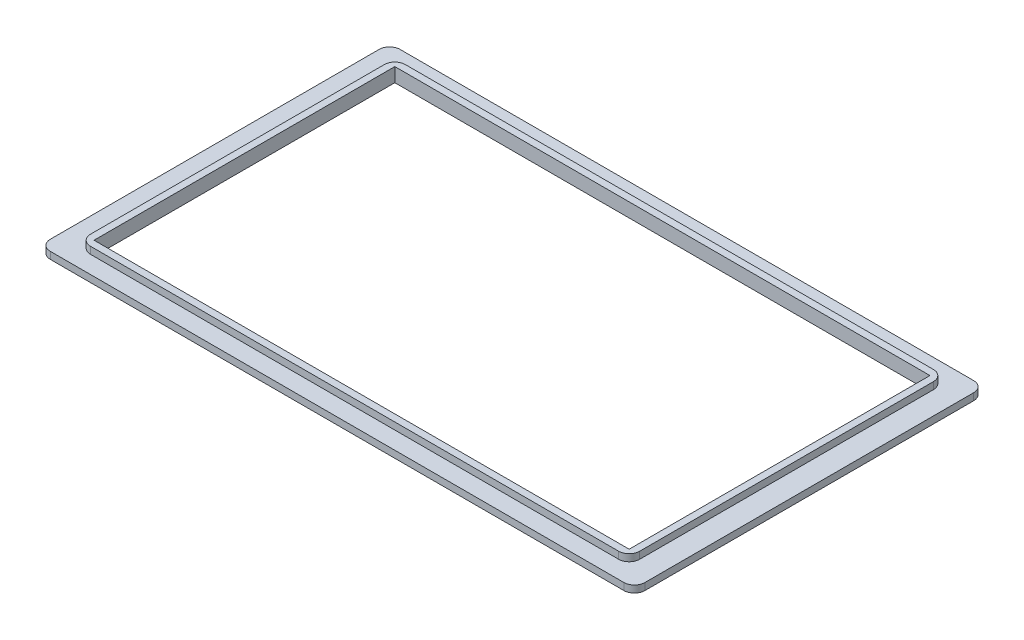
from build123d import *

# Parameters (mm, degrees)
ESQUISSE3_W                  = 170
ESQUISSE3_H                  = 100
BOSS_EXTRU_2_DEPTH           = 2
ESQUISSE5_W                  = 157
ESQUISSE5_H                  = 90
BOSS_EXTRU_3_DEPTH           = 2
ENL_V_MAT_EXTRU_1_DEPTH      = 99.635693337
ENL_V_MAT_EXTRU_1_DEPTH_BACK = 99.635693337
ESQUISSE4_W                  = 153
ESQUISSE4_H                  = 86
CONG_1_R                     = 3
ESQUISSE7_W                  = 19
ESQUISSE7_H                  = 5.500535768
ENL_V_MAT_EXTRU_3_DEPTH      = 1
BOSS_EXTRU_5_DEPTH           = 1


with BuildPart() as part:
    # Esquisse3 → Boss.-Extru.2 (new body)
    with BuildSketch(Plane(origin=(0, 0, 0), x_dir=(1, 0, 0), z_dir=(0, 1, 0))):
        Rectangle(ESQUISSE3_W, ESQUISSE3_H)
    extrude(amount=BOSS_EXTRU_2_DEPTH)

    # Esquisse5 → Boss.-Extru.3 (add)
    with BuildSketch(Plane(origin=(0, 2, 0), x_dir=(1, 0, 0), z_dir=(0, 1, 0))):
        Rectangle(ESQUISSE5_W, ESQUISSE5_H)
    extrude(amount=BOSS_EXTRU_3_DEPTH)

    # Esquisse4 → Enlèv. mat.-Extru.1 (cut, two sides: drawn at the far end of the back side and taken through both)
    with BuildSketch(Plane(origin=(0, 2, 0), x_dir=(1, 0, 0), z_dir=(0, 1, 0)).offset(-ENL_V_MAT_EXTRU_1_DEPTH_BACK)):
        Rectangle(ESQUISSE4_W, ESQUISSE4_H)
    extrude(amount=ENL_V_MAT_EXTRU_1_DEPTH + ENL_V_MAT_EXTRU_1_DEPTH_BACK, mode=Mode.SUBTRACT)

    # Congé1
    cong_1_edges = [part.edges().sort_by_distance(p)[0] for p in [
        (78.5, 3, 45),
        (78.5, 3, -45),
        (-78.5, 3, -45),
        (-78.5, 3, 45),
        (85, 1, 50),
        (-85, 1, 50),
        (-85, 1, -50),
        (85, 1, -50),
    ]]
    fillet(cong_1_edges, radius=CONG_1_R)

    # Esquisse7 → Enlèv. mat.-Extru.3 (cut)
    with BuildSketch(Plane(origin=(0, 0, 0), x_dir=(-1, 0, 0), z_dir=(0, -1, 0))):
        with Locations((0, -46.812361921)):
            Rectangle(ESQUISSE7_W, ESQUISSE7_H)
    extrude(amount=-ENL_V_MAT_EXTRU_3_DEPTH, mode=Mode.SUBTRACT)

    # Esquisse10 → Boss.-Extru.5 (add)
    # profile 1 of 5: a face of its own
    with BuildSketch(Plane.XZ.offset(-1)):
        Polygon((-9.10985046, 49.289012025), (-6.789658152, 49.289012025), (-6.789658152, 48.800550486), (-8.682446614, 48.800550486), (-8.682446614, 47.335165871), (-6.789658152, 47.335165871), (-6.789658152, 46.846704332), (-8.682446614, 46.846704332), (-8.682446614, 44.526512025), (-9.10985046, 44.526512025), align=None)
    # profile 2 of 5: a face of its own
    with BuildSketch(Plane.XZ.offset(-1)):
        Polygon((-3.762532251, 49.411127409), (-3.675715844, 49.411127409), (-3.675715844, 46.114012025), (-3.126196614, 46.114012025), (-3.126196614, 45.625550486), (-3.675715844, 45.625550486), (-3.675715844, 44.526512025), (-4.103119691, 44.526512025), (-4.103119691, 45.625550486), (-6.362254306, 45.625550486), align=None)
        Polygon((-4.103119691, 46.114012025), (-4.103119691, 48.182341351), (-5.522711037, 46.114012025), align=None, mode=Mode.SUBTRACT)
    # profile 3 of 5: a face of its own
    with BuildSketch(Plane.XZ.offset(-1)):
        with BuildLine():
            Line((-2.271388921, 44.526512025), (-2.271388921, 49.289012025))
            Line((-2.271388921, 49.289012025), (-1.309730268, 49.289012025))
            add(Edge.make_bspline(
                [(-1.309730268, 49.289012025), (-1.226088537, 49.288409813), (-1.064493149, 49.287246344), (-0.83097764, 49.27986938), (-0.614918307, 49.266819496), (-0.417025738, 49.247810962), (-0.23675666, 49.224470584), (-0.07461584, 49.195214677), (0.070235112, 49.160668631), (0.159320315, 49.131215357), (0.201447617, 49.117287265)],
                knots=[0, 0, 0, 0, 1.314313732, 2.53924729, 3.670748893, 4.714932338, 5.66265055, 6.526160246, 7.303039223, 8, 8, 8, 8], degree=3))
            add(Edge.make_bspline(
                [(0.201447617, 49.117287265), (0.256549387, 49.096290483), (0.365503403, 49.054773057), (0.520634523, 48.976455376), (0.666673678, 48.887718977), (0.804404014, 48.788446892), (0.930679424, 48.675828261), (1.050433027, 48.554647012), (1.158765919, 48.420496449), (1.257973279, 48.276158698), (1.347420729, 48.123334084), (1.425170798, 47.962313811), (1.489742124, 47.79391561), (1.543345051, 47.618607784), (1.585590409, 47.436004855), (1.614412966, 47.245894202), (1.633423491, 47.049027162), (1.635334004, 46.915439767), (1.636303386, 46.847658359)],
                knots=[0, 0, 0, 0, 0.984719456, 1.947108742, 2.898477687, 3.838006223, 4.779231079, 5.722358779, 6.681677486, 7.655904652, 8.64651281, 9.637519902, 10.640069247, 11.656948941, 12.698408672, 13.768548281, 14.867775369, 16, 16, 16, 16], degree=3))
            add(Edge.make_bspline(
                [(1.636303386, 46.847658359), (1.635447541, 46.788792173), (1.633761009, 46.672790207), (1.61861719, 46.501828846), (1.59660584, 46.335939307), (1.562527843, 46.175911551), (1.521158708, 46.020343512), (1.468139631, 45.870893208), (1.407403474, 45.726189667), (1.33657846, 45.588189459), (1.258825361, 45.457447442), (1.175383989, 45.334200027), (1.086343343, 45.220205886), (0.990854357, 45.11511981), (0.890151, 45.019100219), (0.783573964, 44.931345013), (0.670848242, 44.853571272), (0.552478723, 44.782722814), (0.425012275, 44.720918688), (0.286034543, 44.668626424), (0.134952833, 44.62529228), (-0.027862015, 44.589136882), (-0.202691319, 44.560456695), (-0.389706483, 44.541234711), (-0.588620174, 44.528235899), (-0.725207674, 44.527097807), (-0.795510015, 44.526512025)],
                knots=[0, 0, 0, 0, 1.105936401, 2.179363191, 3.223086493, 4.248585256, 5.251745608, 6.245858792, 7.225916811, 8.198733463, 9.158002045, 10.082870192, 10.993790845, 11.873723703, 12.748670949, 13.606408763, 14.465103618, 15.319838547, 16.196477973, 17.123216899, 18.106603292, 19.147568657, 20.255746949, 21.433717677, 22.679120308, 24, 24, 24, 24], degree=3))
            Line((-0.795510015, 44.526512025), (-2.271388921, 44.526512025))
        make_face()
        with BuildLine():
            Line((-1.843985075, 45.014973563), (-1.297327924, 45.014973563))
            add(Edge.make_bspline(
                [(-1.297327924, 45.014973563), (-1.218776105, 45.015311151), (-1.06769219, 45.015960457), (-0.850443272, 45.021658044), (-0.651943094, 45.030967966), (-0.472163468, 45.043996912), (-0.311205903, 45.061235277), (-0.168734015, 45.080455234), (-0.045214824, 45.104400337), (0.029528446, 45.126105035), (0.064067809, 45.136134921)],
                knots=[0, 0, 0, 0, 1.375205317, 2.645023457, 3.804390687, 4.853969522, 5.800190428, 6.637939096, 7.370582563, 8, 8, 8, 8], degree=3))
            add(Edge.make_bspline(
                [(0.064067809, 45.136134921), (0.107540402, 45.151445077), (0.193447245, 45.181699707), (0.317110436, 45.236887096), (0.432440503, 45.302258626), (0.541447359, 45.374923863), (0.642584701, 45.457445745), (0.737051088, 45.54802984), (0.824656325, 45.647137159), (0.904495294, 45.754644693), (0.975944093, 45.869883308), (1.037817445, 45.991720078), (1.092043993, 46.118820059), (1.134605221, 46.253135021), (1.167963927, 46.393464204), (1.191592306, 46.53981748), (1.206308056, 46.692167517), (1.208024526, 46.795788801), (1.20889954, 46.848612385)],
                knots=[0, 0, 0, 0, 0.998632004, 1.973411704, 2.929992603, 3.868527914, 4.809262121, 5.754881198, 6.702106254, 7.672490631, 8.653608572, 9.636854334, 10.631411391, 11.644891563, 12.686317036, 13.754757253, 14.855430412, 16, 16, 16, 16], degree=3))
            add(Edge.make_bspline(
                [(1.20889954, 46.848612385), (1.208201103, 46.904311157), (1.206829016, 47.013731886), (1.189582901, 47.174283511), (1.164380356, 47.328698253), (1.127935412, 47.47698644), (1.081493037, 47.619437377), (1.0235339, 47.75526321), (0.957312536, 47.885898407), (0.878522638, 48.008327811), (0.792232134, 48.124115221), (0.696467948, 48.230189588), (0.592751532, 48.326792547), (0.482214111, 48.41542854), (0.361740416, 48.492531613), (0.234168429, 48.561501704), (0.097626641, 48.620034042), (0.002631508, 48.651165637), (-0.045645231, 48.666986784)],
                knots=[0, 0, 0, 0, 1.122418816, 2.205001699, 3.251619955, 4.274784885, 5.280384055, 6.268708349, 7.249350384, 8.229342522, 9.199999885, 10.157847722, 11.105861043, 12.055065948, 13.010012805, 13.98527497, 14.976112212, 16, 16, 16, 16], degree=3))
            add(Edge.make_bspline(
                [(-0.045645231, 48.666986784), (-0.085583756, 48.678030924), (-0.170504016, 48.701513794), (-0.30907843, 48.727129747), (-0.465036901, 48.749723726), (-0.639071851, 48.768852701), (-0.830984897, 48.782578664), (-1.040923637, 48.792881059), (-1.268978813, 48.799829727), (-1.427070047, 48.800304218), (-1.509121794, 48.800550486)],
                knots=[0, 0, 0, 0, 0.674548936, 1.434276114, 2.292660221, 3.240891867, 4.284742987, 5.42552168, 6.663806718, 8, 8, 8, 8], degree=3))
            Line((-1.509121794, 48.800550486), (-1.843985075, 48.800550486))
            Line((-1.843985075, 48.800550486), (-1.843985075, 45.014973563))
        make_face(mode=Mode.SUBTRACT)
    # profile 4 of 5: a face of its own
    with BuildSketch(Plane.XZ.offset(-1)):
        Polygon((2.613226463, 49.289012025), (5.299764925, 49.289012025), (5.299764925, 48.800550486), (3.040630309, 48.800550486), (3.040630309, 47.335165871), (5.299764925, 47.335165871), (5.299764925, 46.846704332), (3.040630309, 46.846704332), (3.040630309, 45.014973563), (5.299764925, 45.014973563), (5.299764925, 44.526512025), (2.613226463, 44.526512025), align=None)
    # profile 5 of 5: a face of its own
    with BuildSketch(Plane.XZ.offset(-1)):
        with BuildLine():
            Line((6.154572617, 49.289012025), (7.083794372, 49.289012025))
            add(Edge.make_bspline(
                [(7.083794372, 49.289012025), (7.12928098, 49.288772878), (7.217445346, 49.288309354), (7.345651087, 49.281120522), (7.465732504, 49.271318385), (7.577724423, 49.255765295), (7.681575093, 49.236998627), (7.777597485, 49.214272227), (7.865486255, 49.187021728), (7.970414657, 49.143688038), (8.090049556, 49.079294727), (8.219587369, 48.984141929), (8.330355281, 48.867756685), (8.425858805, 48.736471357), (8.501788186, 48.592050896), (8.556719266, 48.4379375), (8.591496232, 48.276118987), (8.59507278, 48.165025949), (8.596880309, 48.108881315)],
                knots=[0, 0, 0, 0, 1.001505555, 1.941167018, 2.826882275, 3.653841531, 4.429895133, 5.150066043, 5.825578002, 6.45369114, 7.647487171, 8.808567382, 9.977351308, 11.170798116, 12.373658725, 13.556498008, 14.765093433, 16, 16, 16, 16], degree=3))
            add(Edge.make_bspline(
                [(8.596880309, 48.108881315), (8.595392751, 48.056286231), (8.59246956, 47.952931929), (8.564516734, 47.801764588), (8.520755253, 47.657867394), (8.459924182, 47.521765505), (8.380863965, 47.396534053), (8.287167467, 47.281162809), (8.174123675, 47.180536549), (8.08942841, 47.124280671), (8.046407052, 47.095705234)],
                knots=[0, 0, 0, 0, 1.044552857, 2.05264487, 3.044412934, 4.028983338, 5.005914585, 5.980388656, 6.974128949, 8, 8, 8, 8], degree=3))
            add(Edge.make_bspline(
                [(8.046407052, 47.095705234), (8.100509634, 47.074933932), (8.204021275, 47.035193285), (8.346469028, 46.964932172), (8.469198442, 46.888511586), (8.57315313, 46.805056461), (8.66205901, 46.715101258), (8.739691763, 46.617326977), (8.805933204, 46.510458168), (8.862692575, 46.395609071), (8.906982133, 46.273952412), (8.940150774, 46.146629321), (8.959156481, 46.014096355), (8.961861093, 45.923900892), (8.963226463, 45.878367493)],
                knots=[0, 0, 0, 0, 1.27268992, 2.434971085, 3.483601985, 4.442670788, 5.356604649, 6.2567628, 7.179492994, 8.113709626, 9.066344395, 10.018646069, 10.999752585, 12, 12, 12, 12], degree=3))
            add(Edge.make_bspline(
                [(8.963226463, 45.878367493), (8.961897255, 45.831876142), (8.959282, 45.740403107), (8.93998711, 45.606025584), (8.907317575, 45.477608246), (8.862317194, 45.35432048), (8.803585616, 45.236400797), (8.732110064, 45.123715606), (8.646886401, 45.017397106), (8.551550854, 44.91626389), (8.443697721, 44.825330365), (8.327335211, 44.744346493), (8.200997897, 44.677744887), (8.06676072, 44.621797729), (7.923117847, 44.579061505), (7.770714299, 44.54916311), (7.609681517, 44.529017685), (7.499178248, 44.527361417), (7.442508314, 44.526512025)],
                knots=[0, 0, 0, 0, 0.978564426, 1.925352924, 2.850884081, 3.763762016, 4.682927383, 5.618979971, 6.567305752, 7.547517671, 8.540179244, 9.531824382, 10.526200242, 11.540722885, 12.589160233, 13.674978461, 14.80764778, 16, 16, 16, 16], degree=3))
            Line((7.442508314, 44.526512025), (6.154572617, 44.526512025))
            Line((6.154572617, 44.526512025), (6.154572617, 49.289012025))
        make_face()
        with BuildLine():
            Line((6.581976463, 48.800550486), (6.581976463, 47.274108178))
            Line((6.581976463, 47.274108178), (6.869138422, 47.274108178))
            add(Edge.make_bspline(
                [(6.869138422, 47.274108178), (6.911114819, 47.274652359), (6.992221771, 47.275703828), (7.109678488, 47.278715792), (7.218705745, 47.287149558), (7.319115346, 47.295580901), (7.410749172, 47.309289536), (7.493404212, 47.325607389), (7.56837766, 47.342865199), (7.654836827, 47.372215108), (7.752907518, 47.415591516), (7.85745542, 47.48290855), (7.94962268, 47.563087759), (8.027451711, 47.655604032), (8.091148748, 47.757475521), (8.135390624, 47.867076812), (8.165390679, 47.981676349), (8.168100584, 48.060350471), (8.169476463, 48.100295077)],
                knots=[0, 0, 0, 0, 1.156816544, 2.235205308, 3.236616184, 4.169592532, 5.011045266, 5.787822928, 6.49130361, 7.128639758, 8.301311294, 9.436451833, 10.541879658, 11.654887649, 12.756523258, 13.837046038, 14.901820046, 16, 16, 16, 16], degree=3))
            add(Edge.make_bspline(
                [(8.169476463, 48.100295077), (8.168760482, 48.126728002), (8.167356008, 48.178579071), (8.155853478, 48.25416587), (8.136303314, 48.325254691), (8.111192294, 48.392819748), (8.076101257, 48.454748373), (8.034785258, 48.513181793), (7.984866516, 48.566130068), (7.928046744, 48.615618564), (7.862720725, 48.659494154), (7.788927431, 48.697921764), (7.705668485, 48.728865463), (7.614347064, 48.755965657), (7.513557477, 48.774999728), (7.404462817, 48.790856659), (7.286169503, 48.798929426), (7.204329203, 48.79999808), (7.16202454, 48.800550486)],
                knots=[0, 0, 0, 0, 0.91205012, 1.789085906, 2.630437955, 3.453916878, 4.269457761, 5.079663411, 5.91843418, 6.774407191, 7.675494373, 8.627863946, 9.638891023, 10.736472738, 11.911756761, 13.175263542, 14.539845004, 16, 16, 16, 16], degree=3))
            Line((7.16202454, 48.800550486), (6.581976463, 48.800550486))
        make_face(mode=Mode.SUBTRACT)
        with BuildLine():
            Line((6.581976463, 46.78564664), (6.581976463, 45.014973563))
            Line((6.581976463, 45.014973563), (7.190645333, 45.014973563))
            add(Edge.make_bspline(
                [(7.190645333, 45.014973563), (7.234213943, 45.015495734), (7.318186695, 45.016502149), (7.439428012, 45.019787667), (7.551800021, 45.027261085), (7.654789949, 45.039025617), (7.749509886, 45.051787006), (7.834823546, 45.068947356), (7.911422499, 45.088608263), (8.000242182, 45.118998691), (8.100259455, 45.166210674), (8.208042799, 45.23739539), (8.30387276, 45.322199605), (8.385250631, 45.42034917), (8.451943305, 45.527071797), (8.500460192, 45.640208863), (8.530383465, 45.757890955), (8.534005916, 45.838127803), (8.535822617, 45.878367493)],
                knots=[0, 0, 0, 0, 1.160039823, 2.235823828, 3.228722157, 4.157150951, 4.99529583, 5.772374946, 6.472645482, 7.099169577, 8.269452708, 9.405989375, 10.527446681, 11.663510218, 12.788923519, 13.866172445, 14.929861265, 16, 16, 16, 16], degree=3))
            add(Edge.make_bspline(
                [(8.535822617, 45.878367493), (8.535446918, 45.903531646), (8.53470158, 45.953454051), (8.523461243, 46.026818077), (8.507113799, 46.097882568), (8.485979955, 46.166840494), (8.455201323, 46.232445124), (8.41926956, 46.295993964), (8.377139938, 46.35757102), (8.311493413, 46.43542055), (8.216009391, 46.525114771), (8.080336957, 46.612931873), (7.926069652, 46.683754067), (7.814181527, 46.713825141), (7.756383014, 46.72935908)],
                knots=[0, 0, 0, 0, 0.723448775, 1.435228256, 2.130040452, 2.821711965, 3.505591119, 4.210454504, 4.921174351, 5.648778258, 7.137944449, 8.670945889, 10.280296675, 12, 12, 12, 12], degree=3))
            add(Edge.make_bspline(
                [(7.756383014, 46.72935908), (7.73321128, 46.734060462), (7.682970181, 46.744254028), (7.601044866, 46.755014153), (7.507514987, 46.764600467), (7.402164572, 46.771691363), (7.284860331, 46.77902091), (7.155351738, 46.781871363), (7.014167678, 46.785272142), (6.916206628, 46.785518614), (6.865322317, 46.78564664)],
                knots=[0, 0, 0, 0, 0.634451884, 1.375622551, 2.216452059, 3.157844607, 4.20941857, 5.370758133, 6.634282058, 8, 8, 8, 8], degree=3))
            Line((6.865322317, 46.78564664), (6.581976463, 46.78564664))
        make_face(mode=Mode.SUBTRACT)
    extrude(amount=BOSS_EXTRU_5_DEPTH)


solid = part.part
